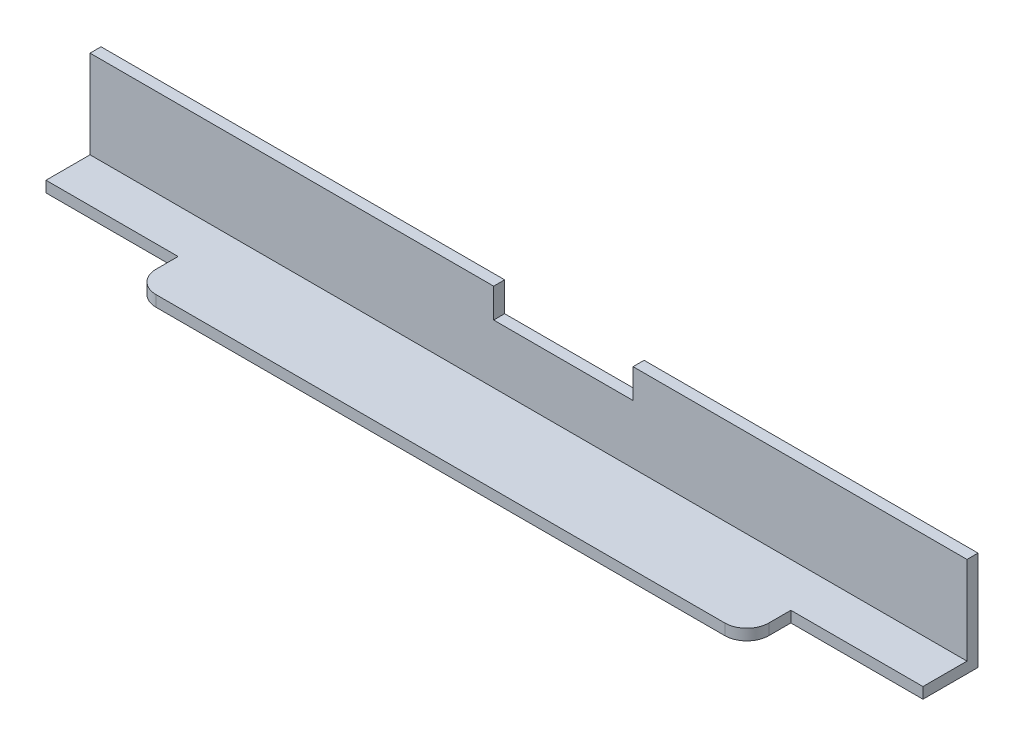
from build123d import *

# Parameters (mm, degrees)
SKETCH2_W           = 239
SKETCH2_H           = 27
BOSS_EXTRUDE1_DEPTH = 3
SKETCH3_W           = 239
SKETCH3_H           = 3
BOSS_EXTRUDE2_DEPTH = 12
BOSS_EXTRUDE4_DEPTH = 3
SKETCH5_W           = 38
SKETCH5_H           = 8
CUT_EXTRUDE1_DEPTH  = 3


with BuildPart() as part:
    # Sketch2 → Boss-Extrude1 (new body)
    with BuildSketch(Plane.XY):
        with Locations((-119.5, -13.5)):
            Rectangle(SKETCH2_W, SKETCH2_H)
    extrude(amount=BOSS_EXTRUDE1_DEPTH)

    # Sketch3 → Boss-Extrude2 (add)
    with BuildSketch(Plane.XY.offset(3)):
        with Locations((-119.5, -25.5)):
            Rectangle(SKETCH3_W, SKETCH3_H)
    extrude(amount=BOSS_EXTRUDE2_DEPTH)

    # Sketch4 → Boss-Extrude4 (add)
    with BuildSketch(Plane(origin=(0, -24, 0), x_dir=(1, 0, 0), z_dir=(0, 1, 0))):
        with BuildLine():
            Line((-203, -15), (-36, -15))
            Line((-36, -15), (-36, -21))
            ThreePointArc((-36, -21), (-37.757359313, -25.242640687), (-42, -27))
            Line((-42, -27), (-197, -27))
            ThreePointArc((-197, -27), (-201.242640687, -25.242640687), (-203, -21))
            Line((-203, -21), (-203, -15))
        make_face()
    extrude(amount=-BOSS_EXTRUDE4_DEPTH)

    # Sketch5 → Cut-Extrude1 (cut)
    with BuildSketch(Plane(origin=(0, 0, 0), x_dir=(-1, 0, 0), z_dir=(0, 0, -1))):
        with Locations((110, -4)):
            Rectangle(SKETCH5_W, SKETCH5_H)
    extrude(amount=-CUT_EXTRUDE1_DEPTH, mode=Mode.SUBTRACT)


solid = part.part
